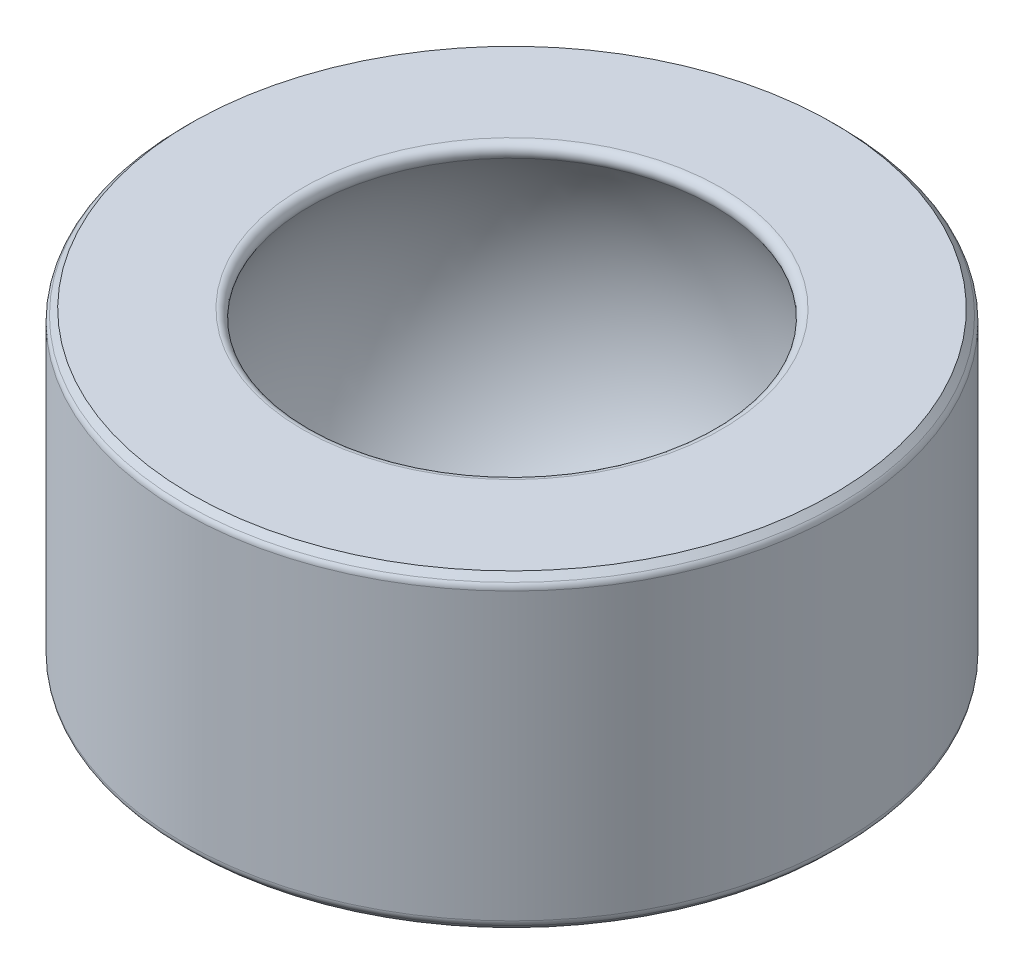
from build123d import *

# Parameters (mm, degrees)
BOSS_EXTRUDE1_DEPTH      = 1.875
BOSS_EXTRUDE1_DEPTH_BACK = 1.875
SKETCH1_R                = 4
SKETCH1_R_2              = 2
CHAMFER1_SIZE            = 0.1
FILLET1_R                = 0.1
FILLET2_R                = 0.1


with BuildPart() as part:
    # Sketch1 → Boss-Extrude1 (new, two sides: drawn at the far end of the back side and taken through both)
    with BuildSketch(Plane(origin=(0, 0, 0), x_dir=(1, 0, 0), z_dir=(0, 1, 0)).offset(-BOSS_EXTRUDE1_DEPTH_BACK)):
        Circle(SKETCH1_R)
        Circle(SKETCH1_R_2, mode=Mode.SUBTRACT)
    extrude(amount=BOSS_EXTRUDE1_DEPTH + BOSS_EXTRUDE1_DEPTH_BACK)


with BuildPart() as body_2:
    # Sketch2 → Revolve1 (revolve)
    with BuildSketch(Plane(origin=(0, 0, 0), x_dir=(1, 0, 0), z_dir=(0, 1, 0))):
        with BuildLine():
            Line((0, 3), (0, -3))
            ThreePointArc((0, -3), (-3, 0), (0, 3))
        make_face()
    revolve(axis=Axis((0, 0, -3), (0, 0, 1)))


with BuildPart() as part_1:
    add(part.part)

    # Combine1: cut body 2
    add(body_2.part, mode=Mode.SUBTRACT)

    # Chamfer1
    chamfer1_edges = [part_1.edges().sort_by_distance(p)[0] for p in [
        (-4, 1.875, 0),
        (-4, -1.875, 0),
    ]]
    chamfer(chamfer1_edges, length=CHAMFER1_SIZE)

    # Fillet1
    fillet1_edges = [part_1.edges().sort_by_distance(p)[0] for p in [
        (-4, -1.775, 0),
        (-4, 1.775, 0),
    ]]
    fillet(fillet1_edges, radius=FILLET1_R)

    # Fillet2
    fillet2_edges = [part_1.edges().sort_by_distance(p)[0] for p in [
        (0, -1.875, -2.341874249),
        (0, 1.875, -2.341874249),
    ]]
    fillet(fillet2_edges, radius=FILLET2_R)


solid = part_1.part
